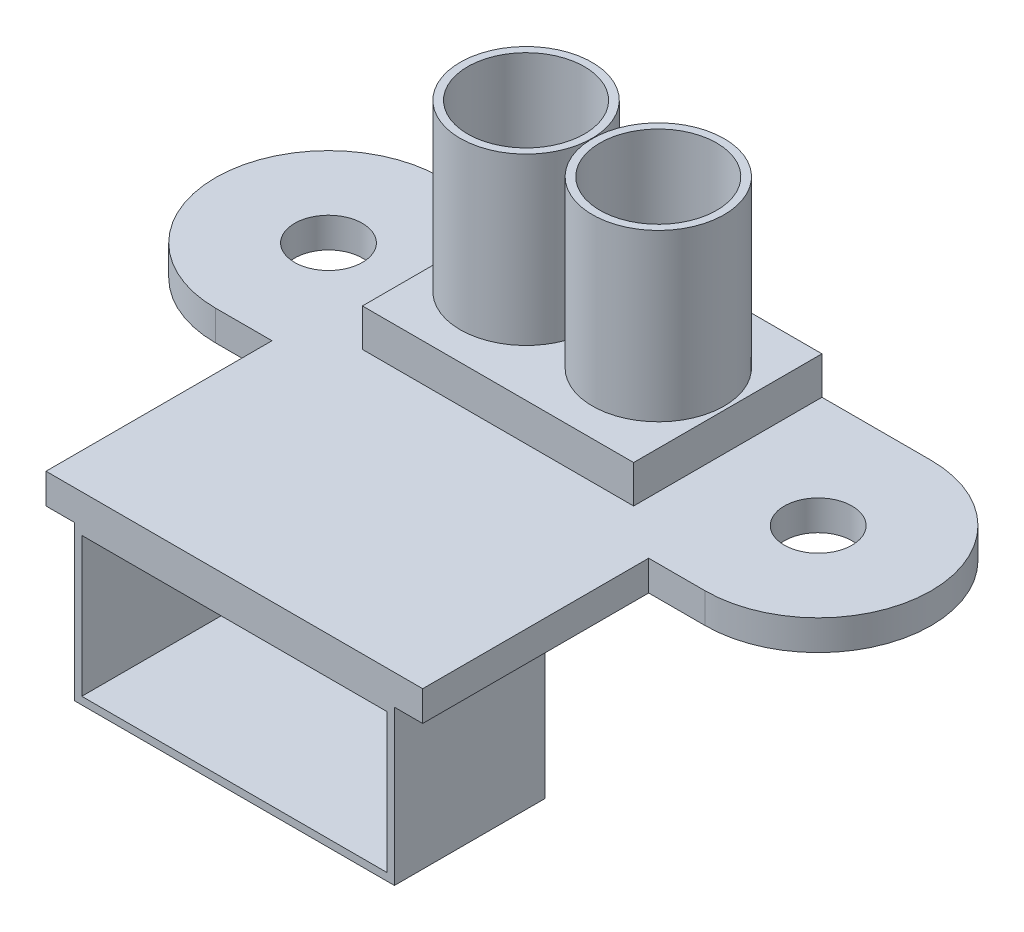
from build123d import *

# Parameters (mm, degrees)
SKETCH_2_R          = 0.9
EXTRUDE_1_DEPTH     = 0.8
SKETCH_3_W          = 7.2
SKETCH_3_H          = 5
EXTRUDE_2_DEPTH     = 1
SKETCH_4_R          = 1.75
SKETCH_4_R_2        = 1.55
EXTRUDE_5_DEPTH     = 4.4
SKETCH_6_W          = 8.5
SKETCH_6_H          = 4
EXTRUDE_6_DEPTH     = 4.1
SKETCH_7_W          = 8.1
SKETCH_7_H          = 3.7
CUT_EXTRUDE_1_DEPTH = 3.8


with BuildPart() as part:
    # 草图2 → 凸台-拉伸1 (new body)
    with BuildSketch(Plane(origin=(0, 0, 0), x_dir=(1, 0, 0), z_dir=(0, 1, 0))):
        with BuildLine():
            Line((-6.5, 3), (6.5, 3))
            ThreePointArc((6.5, 3), (9.5, 0), (6.5, -3))
            Line((6.5, -3), (5, -3))
            Line((5, -3), (5, -9))
            Line((5, -9), (-5, -9))
            Line((-5, -9), (-5, -3))
            Line((-5, -3), (-6.5, -3))
            ThreePointArc((-6.5, -3), (-9.5, 0), (-6.5, 3))
        make_face()
        with Locations(Location((-6.5, 0, 0), (0, 0, 270))):
            Circle(SKETCH_2_R, mode=Mode.SUBTRACT)
        with Locations(Location((6.5, 0, 0), (0, 0, 270))):
            Circle(SKETCH_2_R, mode=Mode.SUBTRACT)
    extrude(amount=EXTRUDE_1_DEPTH)

    # 草图3 → 凸台-拉伸2 (add)
    with BuildSketch(Plane(origin=(0, 0.8, 0), x_dir=(1, 0, 0), z_dir=(0, 1, 0))):
        with Locations((0, 0.5)):
            Rectangle(SKETCH_3_W, SKETCH_3_H)
    extrude(amount=EXTRUDE_2_DEPTH)

    # 草图4 → 凸台-拉伸5 (add)
    # profile 1 of 2: a face of its own
    with BuildSketch(Plane(origin=(0, 1.8, 0), x_dir=(1, 0, 0), z_dir=(0, 1, 0))):
        with Locations(Location((-1.755, 0.5, 0), (0, 0, 270))):
            Circle(SKETCH_4_R)
        with Locations(Location((-1.755, 0.5, 0), (0, 0, 270))):
            Circle(SKETCH_4_R_2, mode=Mode.SUBTRACT)
    # profile 2 of 2: a face of its own
    with BuildSketch(Plane(origin=(0, 1.8, 0), x_dir=(1, 0, 0), z_dir=(0, 1, 0))):
        with Locations(Location((1.755, 0.5, 0), (0, 0, 90))):
            Circle(SKETCH_4_R)
        with Locations(Location((1.755, 0.5, 0), (0, 0, 90))):
            Circle(SKETCH_4_R_2, mode=Mode.SUBTRACT)
    extrude(amount=EXTRUDE_5_DEPTH)

    # 草图6 → 凸台-拉伸6 (add)
    with BuildSketch(Plane.XZ):
        with Locations((0, 7)):
            Rectangle(SKETCH_6_W, SKETCH_6_H)
    extrude(amount=EXTRUDE_6_DEPTH)

    # 草图7 → 切除-拉伸1 (cut)
    with BuildSketch(Plane.XY.offset(9)):
        with Locations((0, -2.05)):
            Rectangle(SKETCH_7_W, SKETCH_7_H)
    extrude(amount=-CUT_EXTRUDE_1_DEPTH, mode=Mode.SUBTRACT)


solid = part.part
